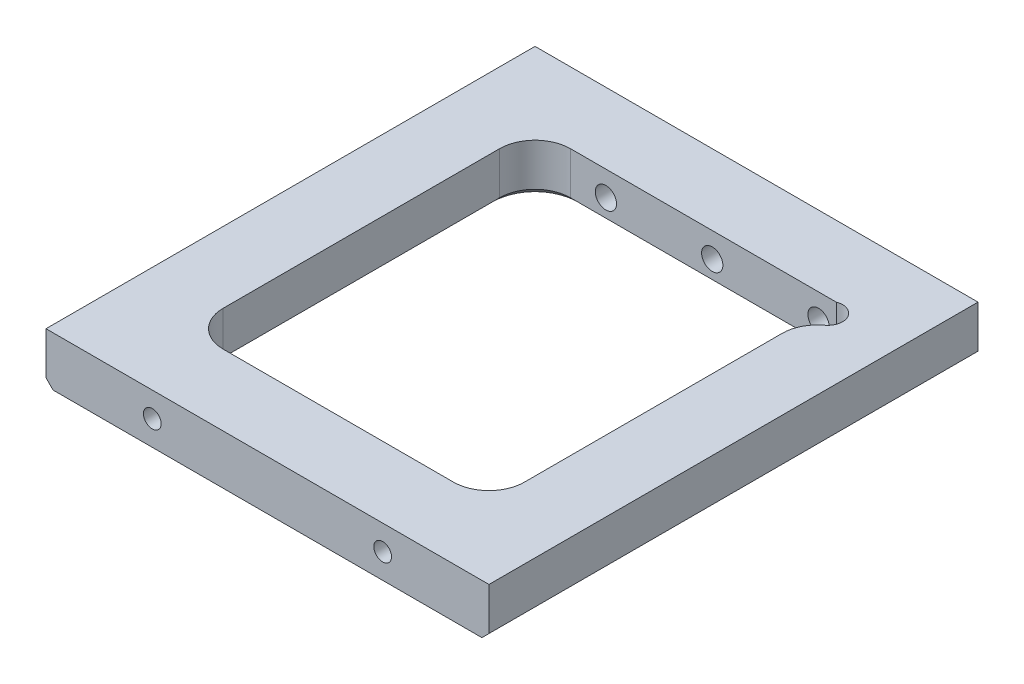
from build123d import *

# Parameters (mm, degrees)
BOSS_EXTRUDE1_DEPTH       = 138
CUT_EXTRUDE1_DEPTH        = 187.721718073
F_6_0MM_DOWEL_HOLE1_D     = 6
F_6_0MM_DOWEL_HOLE1_DEPTH = 28.197418143
F_6_0MM_DOWEL_HOLE1_TIP   = 1.802581857
M6X1_0_TAPPED_HOLE1_D     = 5
M6X1_0_TAPPED_HOLE1_DEPTH = 21.497848452
M6X1_0_TAPPED_HOLE1_TIP   = 1.502151548
CHAMFER1_SIZE             = 2


with BuildPart() as part:
    # Sketch1 → Boss-Extrude1 (new body)
    with BuildSketch(Plane.XY):
        Polygon((-125, 202.5), (-125, 197.5), (-125, 193), (0, 193), (0, 207), (-125, 207), align=None)
    extrude(amount=BOSS_EXTRUDE1_DEPTH)

    # Sketch3 → Cut-Extrude1 (cut, through all)
    with BuildSketch(Plane(origin=(0, 207, 0), x_dir=(1, 0, 0), z_dir=(0, 1, 0))):
        with BuildLine():
            Line((-105, -30), (-105, -108))
            ThreePointArc((-105, -108), (-102.071067812, -115.071067812), (-95, -118))
            Line((-95, -118), (-30, -118))
            ThreePointArc((-30, -118), (-22.928932188, -115.071067812), (-20, -108))
            Line((-20, -108), (-20, -35.297163281))
            ThreePointArc((-20, -35.297163281), (-18.9403759, -30.817243777), (-15.986064246, -27.286730407))
            ThreePointArc((-15.986064246, -27.286730407), (-14.821532054, -21.896326846), (-20, -20))
            Line((-20, -20), (-95, -20))
            ThreePointArc((-95, -20), (-102.071067812, -22.928932188), (-105, -30))
        make_face()
    extrude(amount=-CUT_EXTRUDE1_DEPTH, mode=Mode.SUBTRACT)

    # Ø6.0mm Dowel Hole1
    with Locations(Plane.XY.offset(20)):
        with Locations((-25, 200), (-55, 200), (-85, 200)):
            Hole(F_6_0MM_DOWEL_HOLE1_D / 2, depth=F_6_0MM_DOWEL_HOLE1_DEPTH)
            with Locations((0, 0, -(F_6_0MM_DOWEL_HOLE1_DEPTH + F_6_0MM_DOWEL_HOLE1_TIP / 2))):  # 118° drill point
                Cone(0, F_6_0MM_DOWEL_HOLE1_D / 2, F_6_0MM_DOWEL_HOLE1_TIP, mode=Mode.SUBTRACT)

    # M6x1.0 Tapped Hole1
    with Locations(Plane.XY.offset(138)):
        with Locations((-95, 200), (-30, 200)):
            Hole(M6X1_0_TAPPED_HOLE1_D / 2, depth=M6X1_0_TAPPED_HOLE1_DEPTH)
            with Locations((0, 0, -(M6X1_0_TAPPED_HOLE1_DEPTH + M6X1_0_TAPPED_HOLE1_TIP / 2))):  # 118° drill point
                Cone(0, M6X1_0_TAPPED_HOLE1_D / 2, M6X1_0_TAPPED_HOLE1_TIP, mode=Mode.SUBTRACT)

    # Chamfer1
    chamfer1_edges = [part.edges().sort_by_distance(p)[0] for p in [
        (0, 193, 69),
        (-125, 193, 69),
        (-18.9403759, 193, 30.817243777),
        (-20, 193, 71.648581641),
        (-22.928932188, 193, 115.071067812),
        (-62.5, 193, 118),
        (-102.071067812, 193, 115.071067812),
        (-105, 193, 69),
        (-102.071067812, 193, 22.928932188),
        (-57.5, 193, 20),
        (-14.821532054, 193, 21.896326846),
    ]]
    chamfer(chamfer1_edges, length=CHAMFER1_SIZE)


solid = part.part
